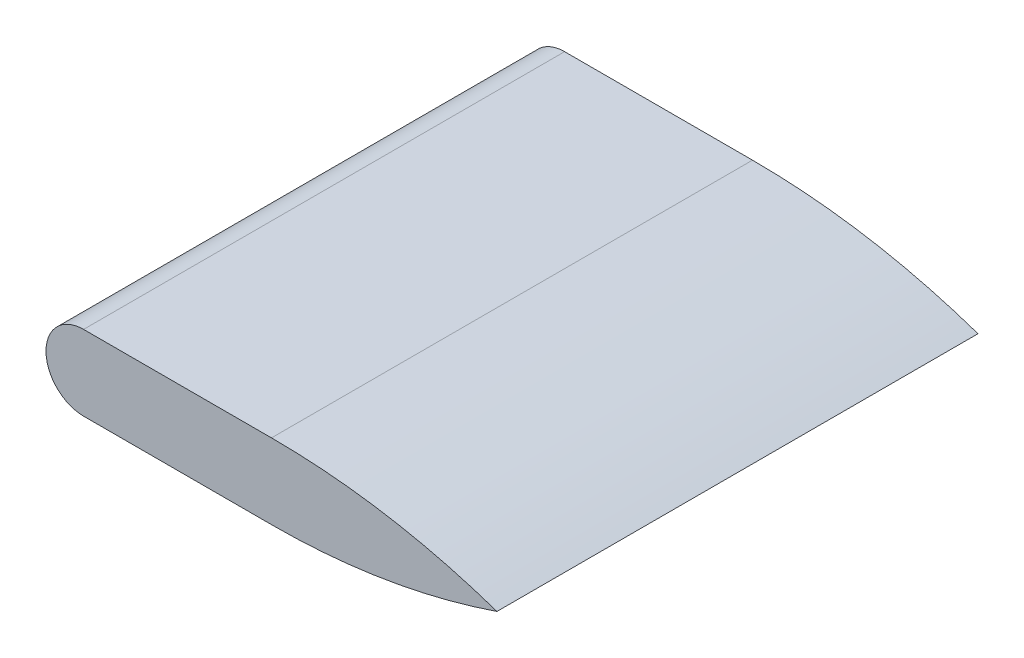
from build123d import *

# Parameters (mm, degrees)
BOSS_EXTRU_1_DEPTH      = 32
ENL_V_MAT_EXTRU_2_DEPTH = 25


with BuildPart() as part:
    # Esquisse1 → Boss.-Extru.1 (new body)
    with BuildSketch(Plane.XY):
        with BuildLine():
            Line((-37.240452994, 28.735655929), (-24.740452994, 28.735655929))
            ThreePointArc((-24.740452994, 28.735655929), (-17.136999831, 28.106374906), (-9.740452994, 26.235655929))
            ThreePointArc((-9.740452994, 26.235655929), (-17.136999831, 24.364936952), (-24.740452994, 23.735655929))
            Line((-24.740452994, 23.735655929), (-37.240452994, 23.735655929))
            ThreePointArc((-37.240452994, 23.735655929), (-39.740452994, 26.235655929), (-37.240452994, 28.735655929))
        make_face()
    extrude(amount=BOSS_EXTRU_1_DEPTH)

    # Esquisse3 → Enlèv. mat.-Extru.2 (cut)
    with BuildSketch(Plane(origin=(0, 0, 0), x_dir=(-1, 0, 0), z_dir=(0, 0, -1))):
        with BuildLine():
            Line((37.240452994, 25.235655929), (27.240452994, 25.235655929))
            Line((27.240452994, 25.235655929), (27.240452994, 27.235655929))
            Line((27.240452994, 27.235655929), (37.240452994, 27.235655929))
            ThreePointArc((37.240452994, 27.235655929), (38.240452994, 26.235655929), (37.240452994, 25.235655929))
        make_face()
    extrude(amount=-ENL_V_MAT_EXTRU_2_DEPTH, mode=Mode.SUBTRACT)


solid = part.part
